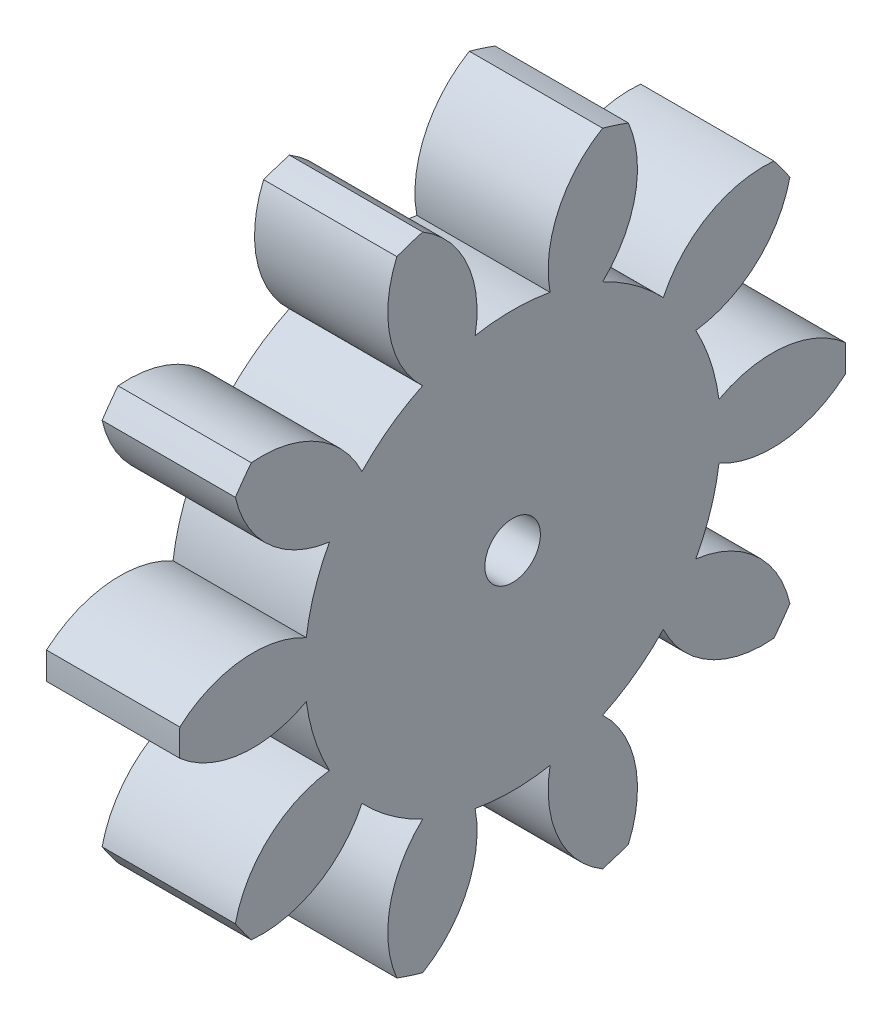
from build123d import *

# Parameters (mm, degrees)
BASPROSKE_W     = 12
BASPROSKE_H     = 30
TOOTHCUT_DEPTH  = 45.09081537
TEETHCUTS_COUNT = 10
TEETHCUTS_ANGLE = 324
BORSKE_R        = 2.5
BORE_DEPTH      = 50.0000508


with BuildPart() as part:
    # BasProSke → Base-Revolve (revolve)
    with BuildSketch(Plane(origin=(0, 0, 0), x_dir=(1, 0, 0), z_dir=(0, 1, 0)), mode=Mode.PRIVATE) as base_revolve_sk:
        with Locations((6, 15)):
            Rectangle(BASPROSKE_W, BASPROSKE_H)
    revolve(base_revolve_sk.sketch.rotate(Axis((-10, 0, 0), (1, 0, 0)), 180), axis=Axis((-10, 0, 0), (1, 0, 0)))

    # TooCutSke → ToothCut (cut, through all)
    with BuildSketch(Plane(origin=(0, 0, 0), x_dir=(0, 0, -1), z_dir=(1, 0, 0))):
        with BuildLine():
            ThreePointArc((3.373955922, 18.44292337), (0, 18.749), (-3.373955922, 18.44292337))
            ThreePointArc((-3.373955922, 18.44292337), (-4.099522353, 24.424717538), (-8.130302123, 28.903681989))
            ThreePointArc((-8.130302123, 28.903681989), (0, 30.0254), (8.130302123, 28.903681989))
            ThreePointArc((8.130302123, 28.903681989), (4.099522353, 24.424717538), (3.373955922, 18.44292337))
        make_face()
    toothcut = extrude(amount=TOOTHCUT_DEPTH, mode=Mode.SUBTRACT)

    # TeethCuts: ToothCut ×10 about axis
    teethcuts_axis = Axis((-10, 0, 0), (1, 0, 0))
    for i in range(1, TEETHCUTS_COUNT):
        add(toothcut.rotate(teethcuts_axis, i * TEETHCUTS_ANGLE / (TEETHCUTS_COUNT - 1)), mode=Mode.SUBTRACT)

    # BorSke → Bore (cut, symmetric)
    with BuildSketch(Plane(origin=(0, 0, 0), x_dir=(0, 0, -1), z_dir=(1, 0, 0))):
        with Locations(Location((0, 0, 0), (0, 0, 180))):
            Circle(BORSKE_R)
    extrude(amount=BORE_DEPTH, both=True, mode=Mode.SUBTRACT)


solid = part.part
